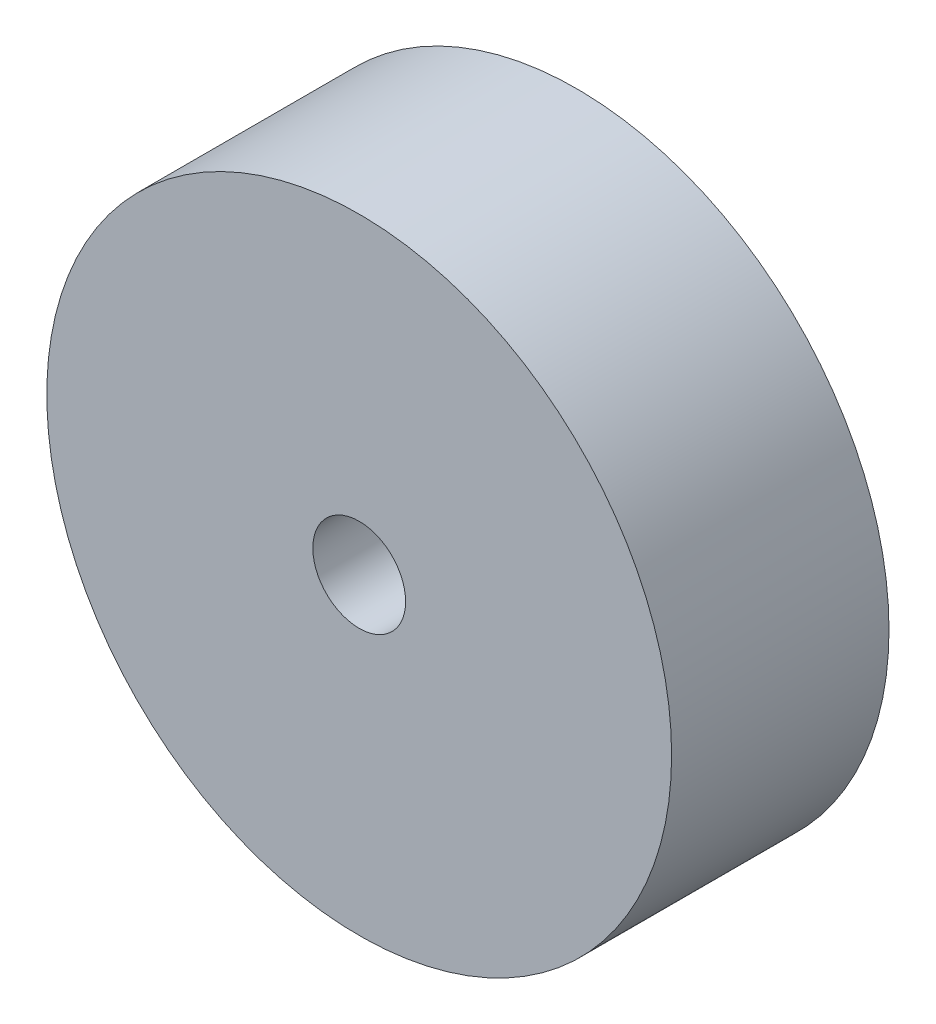
from build123d import *

# Parameters (mm, degrees)
CROQUIS1_R              = 27.275
SALIENTE_EXTRUIR1_DEPTH = 9.49
CROQUIS2_R              = 4.05
CORTAR_EXTRUIR3_DEPTH   = 66


with BuildPart() as part:
    # Croquis1 → Saliente-Extruir1 (new, symmetric)
    with BuildSketch(Plane.XY):
        Circle(CROQUIS1_R)
    extrude(amount=SALIENTE_EXTRUIR1_DEPTH, both=True)

    # Croquis2 → Cortar-Extruir3 (cut)
    with BuildSketch(Plane(origin=(0, 0, -9.49), x_dir=(-1, 0, 0), z_dir=(0, 0, -1))):
        Circle(CROQUIS2_R)
    extrude(amount=-CORTAR_EXTRUIR3_DEPTH, mode=Mode.SUBTRACT)


solid = part.part
